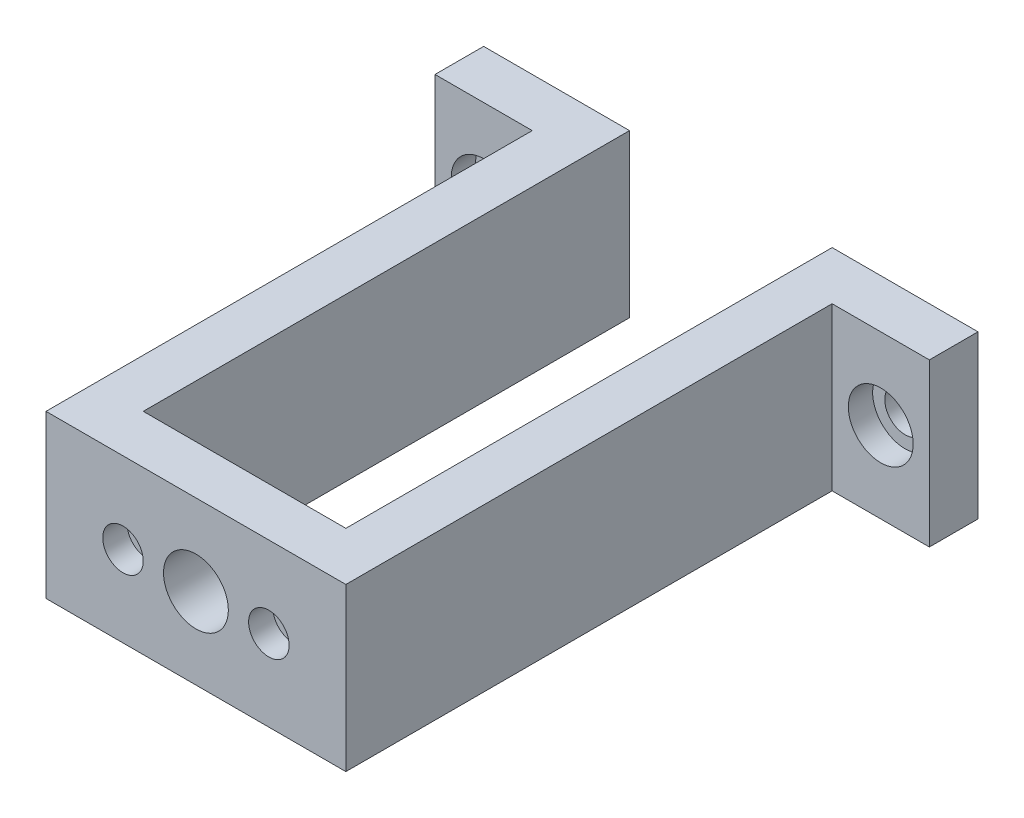
from build123d import *

# Parameters (mm, degrees)
SKETCH_1_W          = 12.5
SKETCH_1_H          = 10
EXTRUDE_1_DEPTH     = 3
SKETCH_2_R          = 0.85
SKETCH_2_R_2        = 2
CUT_EXTRUDE_1_DEPTH = 14.793114224
SKETCH_2_3_R        = 1.25
SKETCH_2_3_R_2      = 2
CUT_EXTRUDE_2_DEPTH = 1.5
SKETCH_3_W          = 9
SKETCH_3_H          = 10
EXTRUDE_2_DEPTH     = 30
EXTRUDE_2_2_DEPTH   = 30
SKETCH_3_3_W        = 3
SKETCH_3_3_H        = 10
EXTRUDE_3_DEPTH     = 3
SKETCH_3_4_W        = 6
SKETCH_3_4_H        = 10
SKETCH_3_4_R        = 2
SKETCH_3_4_R_2      = 1.25
CUT_EXTRUDE_3_DEPTH = 27
SKETCH_3_5_R        = 1.25
CUT_EXTRUDE_4_DEPTH = 38.245805133
CUT_EXTRUDE_START   = 27
SKETCH_3_6_R        = 2
SKETCH_3_6_R_2      = 1.25
CUT_EXTRUDE_5_DEPTH = 1.5


with BuildPart() as part:
    # 草图1 → 凸台-拉伸1 (new body)
    with BuildSketch(Plane.XY):
        with Locations((-6.25, 0)):
            Rectangle(SKETCH_1_W, SKETCH_1_H)
    extrude(amount=EXTRUDE_1_DEPTH)

    # 草图2 → 切除-拉伸1 (cut, through all)
    with BuildSketch(Plane.XY.offset(3)):
        with Locations((-10.75, 0)):
            Circle(SKETCH_2_R)
        with Locations((-1.75, 0)):
            Circle(SKETCH_2_R)
        with Locations((-6.25, 0)):
            Circle(SKETCH_2_R_2)
    extrude(amount=-CUT_EXTRUDE_1_DEPTH, mode=Mode.SUBTRACT)

    # 草图2<3> → 切除-拉伸2 (cut)
    with BuildSketch(Plane.XY.offset(3)):
        with Locations((-1.75, 0)):
            Circle(SKETCH_2_3_R)
        with Locations((-10.75, 0)):
            Circle(SKETCH_2_3_R)
        with Locations((-6.25, 0)):
            Circle(SKETCH_2_3_R_2)
    extrude(amount=-CUT_EXTRUDE_2_DEPTH, mode=Mode.SUBTRACT)



with BuildPart() as body_2:
    # 草图3 → 凸台-拉伸2 (new body)
    with BuildSketch(Plane(origin=(0, 0, 0), x_dir=(-1, 0, 0), z_dir=(0, 0, -1))):
        with Locations((-4.5, 0)):
            Rectangle(SKETCH_3_W, SKETCH_3_H)
    extrude(amount=EXTRUDE_2_DEPTH)


with BuildPart() as body_3:
    # 草图3 → Extrude 2 2 (new body)
    with BuildSketch(Plane(origin=(0, 0, 0), x_dir=(-1, 0, 0), z_dir=(0, 0, -1))):
        with Locations((17, 0)):
            Rectangle(SKETCH_3_W, SKETCH_3_H)
    extrude(amount=EXTRUDE_2_2_DEPTH)


with BuildPart() as part_1:
    add(part.part)

    add(body_2.part)  # 凸台-拉伸3 merges body 2

    add(body_3.part)  # 凸台-拉伸3 merges body 3
    # 草图3<3> → 凸台-拉伸3 (add)
    with BuildSketch(Plane(origin=(0, 0, 0), x_dir=(-1, 0, 0), z_dir=(0, 0, -1))):
        with Locations((14, 0)):
            Rectangle(SKETCH_3_3_W, SKETCH_3_3_H)
        with Locations((-1.5, 0)):
            Rectangle(SKETCH_3_3_W, SKETCH_3_3_H)
    extrude(amount=-EXTRUDE_3_DEPTH)

    # 草图3<4> → 切除-拉伸3 (cut)
    # profile 1 of 6: a face of its own
    with BuildSketch(Plane(origin=(0, 0, 0), x_dir=(-1, 0, 0), z_dir=(0, 0, -1))):
        with Locations((-6, 0)):
            Rectangle(SKETCH_3_4_W, SKETCH_3_4_H)
        with Locations((-6, 0)):
            Circle(SKETCH_3_4_R, mode=Mode.SUBTRACT)
    # profile 2 of 6: a face of its own
    with BuildSketch(Plane(origin=(0, 0, 0), x_dir=(-1, 0, 0), z_dir=(0, 0, -1))):
        with Locations((18.5, 0)):
            Rectangle(SKETCH_3_4_W, SKETCH_3_4_H)
        with Locations((18.5, 0)):
            Circle(SKETCH_3_4_R, mode=Mode.SUBTRACT)
    # profile 3 of 6: a face of its own
    with BuildSketch(Plane(origin=(0, 0, 0), x_dir=(-1, 0, 0), z_dir=(0, 0, -1))):
        with Locations((-6, 0)):
            Circle(SKETCH_3_4_R)
        with Locations((-6, 0)):
            Circle(SKETCH_3_4_R_2, mode=Mode.SUBTRACT)
    # profile 4 of 6: a face of its own
    with BuildSketch(Plane(origin=(0, 0, 0), x_dir=(-1, 0, 0), z_dir=(0, 0, -1))):
        with Locations((-6, 0)):
            Circle(SKETCH_3_4_R_2)
    # profile 5 of 6: a face of its own
    with BuildSketch(Plane(origin=(0, 0, 0), x_dir=(-1, 0, 0), z_dir=(0, 0, -1))):
        with Locations((18.5, 0)):
            Circle(SKETCH_3_4_R)
        with Locations((18.5, 0)):
            Circle(SKETCH_3_4_R_2, mode=Mode.SUBTRACT)
    # profile 6 of 6: a face of its own
    with BuildSketch(Plane(origin=(0, 0, 0), x_dir=(-1, 0, 0), z_dir=(0, 0, -1))):
        with Locations((18.5, 0)):
            Circle(SKETCH_3_4_R_2)
    extrude(amount=CUT_EXTRUDE_3_DEPTH, mode=Mode.SUBTRACT)

    # 草图3<5> → 切除-拉伸4 (cut, through all)
    with BuildSketch(Plane(origin=(0, 0, 0), x_dir=(-1, 0, 0), z_dir=(0, 0, -1))):
        with Locations(Location((18.5, 0, 0), (0, 0, 180))):
            Circle(SKETCH_3_5_R)
        with Locations(Location((-6, 0, 0), (0, 0, 180))):
            Circle(SKETCH_3_5_R)
    extrude(amount=CUT_EXTRUDE_4_DEPTH, mode=Mode.SUBTRACT)

    # 草图3<6> → 切除-拉伸5 (cut)
    # profile 1 of 2: a face of its own
    with BuildSketch(Plane(origin=(0, 0, 0), x_dir=(-1, 0, 0), z_dir=(0, 0, -1)).offset(CUT_EXTRUDE_START)):
        with Locations(Location((18.5, 0, 0), (0, 0, 180))):
            Circle(SKETCH_3_6_R)
        with Locations(Location((18.5, 0, 0), (0, 0, 180))):
            Circle(SKETCH_3_6_R_2, mode=Mode.SUBTRACT)
    # profile 2 of 2: a face of its own
    with BuildSketch(Plane(origin=(0, 0, 0), x_dir=(-1, 0, 0), z_dir=(0, 0, -1)).offset(CUT_EXTRUDE_START)):
        with Locations(Location((-6, 0, 0), (0, 0, 180))):
            Circle(SKETCH_3_6_R)
        with Locations(Location((-6, 0, 0), (0, 0, 180))):
            Circle(SKETCH_3_6_R_2, mode=Mode.SUBTRACT)
    extrude(amount=CUT_EXTRUDE_5_DEPTH, mode=Mode.SUBTRACT)


solid = part_1.part
